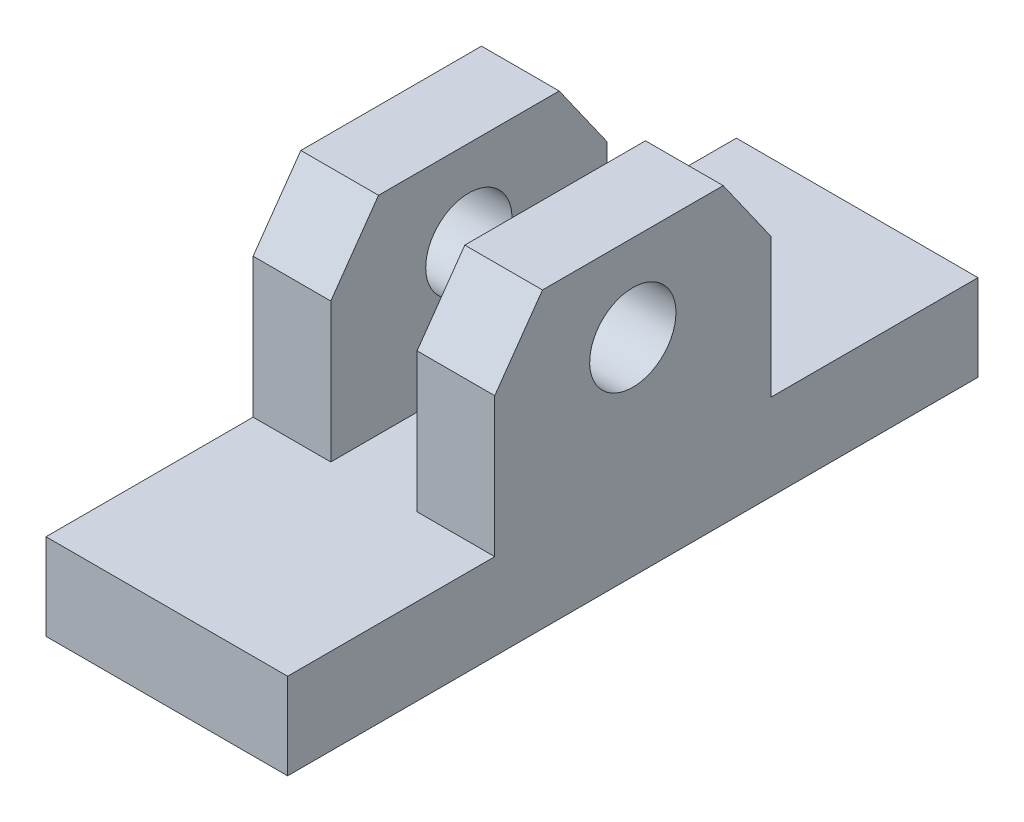
from build123d import *

# Parameters (mm, degrees)
SKETCH_2_R          = 2.5
EXTRUDE_1_DEPTH     = 14
SKETCH_3_W          = 4.998687722
SKETCH_3_H          = 24
CUT_EXTRUDE_2_DEPTH = 16


with BuildPart() as part:
    # Эскиз2 → Вытянуть1 (new body)
    with BuildSketch(Plane(origin=(0, 0, 0), x_dir=(0, 0, -1), z_dir=(1, 0, 0))):
        Polygon((0, 0), (40, 0), (40, 5), (28, 5), (28, 13.077507284), (25.234860189, 17), (14.765139811, 17), (12, 13.077507284), (12, 5), (0, 5), align=None)
        with Locations((20, 12)):
            Circle(SKETCH_2_R, mode=Mode.SUBTRACT)
    extrude(amount=EXTRUDE_1_DEPTH)

    # Эскиз3 → Вытянуть2 (cut)
    with BuildSketch(Plane.XY.offset(-12)):
        with Locations((7, 17)):
            Rectangle(SKETCH_3_W, SKETCH_3_H)
    extrude(amount=-CUT_EXTRUDE_2_DEPTH, mode=Mode.SUBTRACT)


solid = part.part
